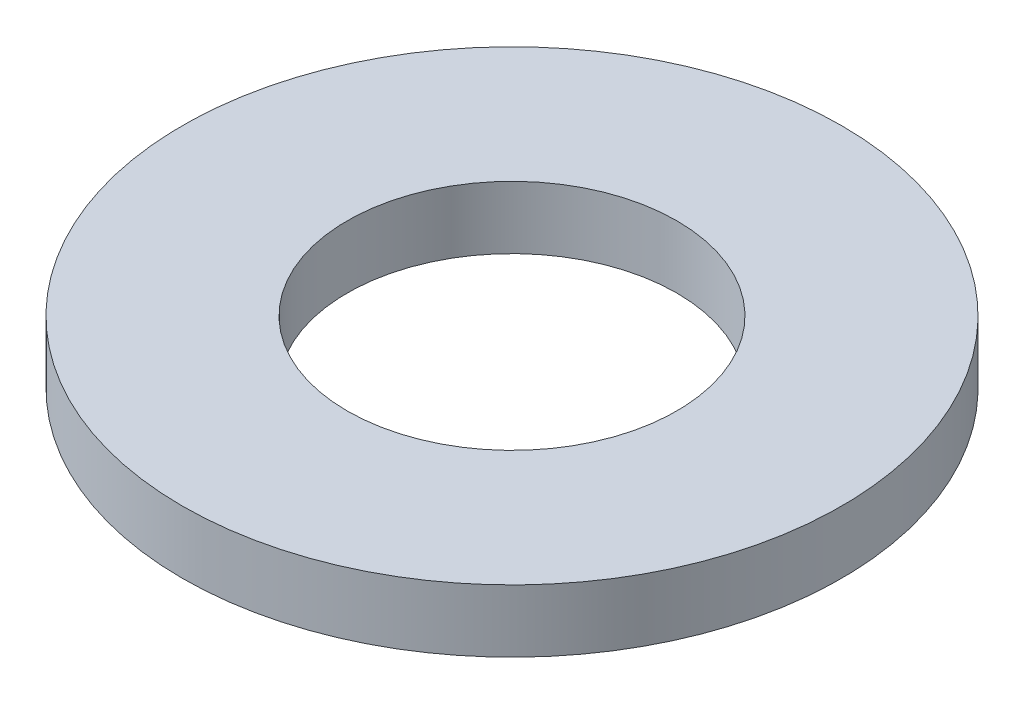
from build123d import *

# Parameters (mm, degrees)
SKETCH1_R           = 6
SKETCH1_R_2         = 3
BOSS_EXTRUDE1_DEPTH = 1.14


with BuildPart() as part:
    # Sketch1 → Boss-Extrude1 (new body)
    with BuildSketch(Plane(origin=(0, 0, 0), x_dir=(1, 0, 0), z_dir=(0, 1, 0))):
        with Locations(Location((0, 0, 0), (0, 0, 270))):
            Circle(SKETCH1_R)
        with Locations(Location((0, 0, 0), (0, 0, 270))):
            Circle(SKETCH1_R_2, mode=Mode.SUBTRACT)
    extrude(amount=BOSS_EXTRUDE1_DEPTH)


solid = part.part
